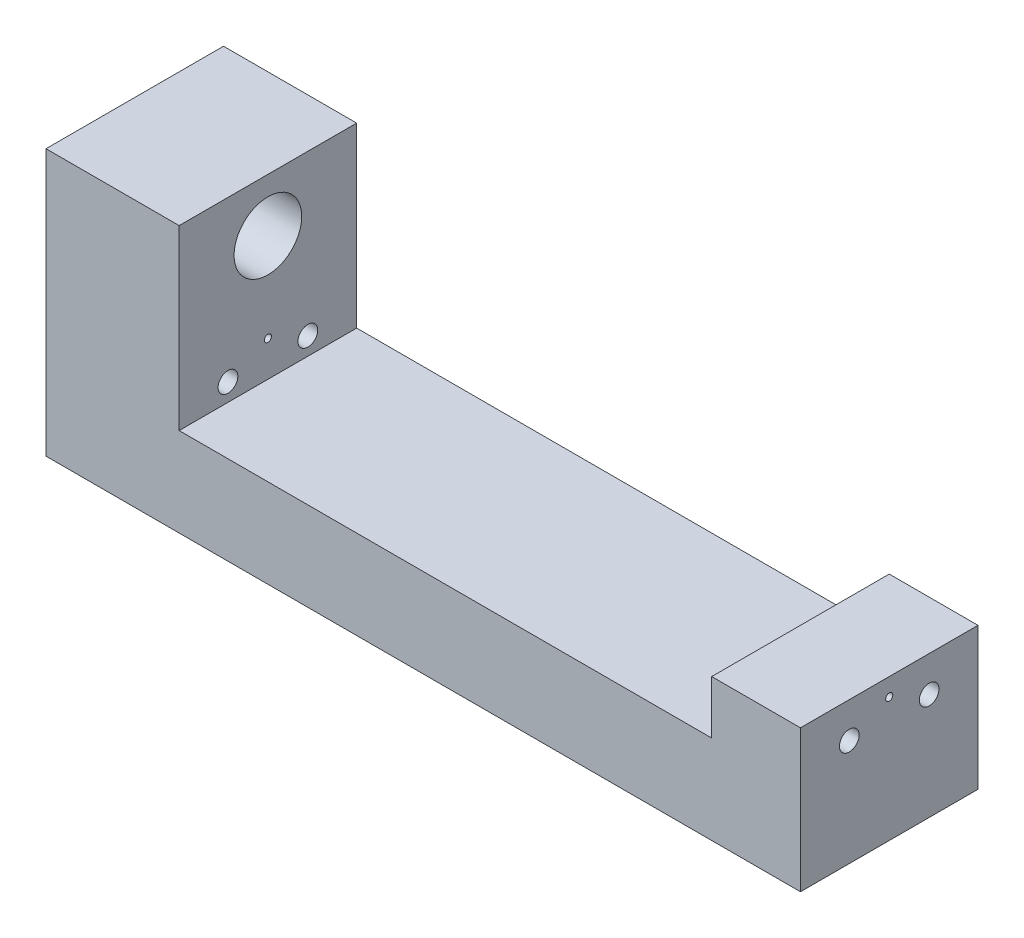
from build123d import *

# Parameters (mm, degrees)
SKETCH1_W               = 850
SKETCH1_H               = 200
BOSS_EXTRUDE1_DEPTH     = 100
SKETCH2_W               = 150
SKETCH2_H               = 200
BOSS_EXTRUDE2_DEPTH     = 200
SKETCH4_W               = 100
SKETCH4_H               = 200
BOSS_EXTRUDE3_DEPTH     = 60
CUT_EXTRUDE1_DEPTH      = 924.309265631
CUT_EXTRUDE1_DEPTH_BACK = 924.309265631
SKETCH3_R               = 38.1
SKETCH3_R_2             = 11.11
SKETCH3_R_3             = 4


with BuildPart() as part:
    # Sketch1 → Boss-Extrude1 (new body)
    with BuildSketch(Plane(origin=(0, 0, 0), x_dir=(1, 0, 0), z_dir=(0, 1, 0))):
        with Locations((425, 100)):
            Rectangle(SKETCH1_W, SKETCH1_H)
    extrude(amount=BOSS_EXTRUDE1_DEPTH)

    # Sketch2 → Boss-Extrude2 (add)
    with BuildSketch(Plane(origin=(0, 100, 0), x_dir=(1, 0, 0), z_dir=(0, 1, 0))):
        with Locations((75, 100)):
            Rectangle(SKETCH2_W, SKETCH2_H)
    extrude(amount=BOSS_EXTRUDE2_DEPTH)

    # Sketch4 → Boss-Extrude3 (add)
    with BuildSketch(Plane(origin=(0, 100, 0), x_dir=(1, 0, 0), z_dir=(0, 1, 0))):
        with Locations((800, 100)):
            Rectangle(SKETCH4_W, SKETCH4_H)
    extrude(amount=BOSS_EXTRUDE3_DEPTH)

    # Sketch3 → Cut-Extrude1 (cut, two sides: drawn at the far end of the back side and taken through both)
    with BuildSketch(Plane.ZY.offset(-CUT_EXTRUDE1_DEPTH_BACK)):
        with Locations((-100, 240)):
            Circle(SKETCH3_R)
        with Locations((-145, 120)):
            Circle(SKETCH3_R_2)
        with Locations(Location((-55, 120, 0), (0, 0, 180))):
            Circle(SKETCH3_R_2)
        with Locations((-100, 140)):
            Circle(SKETCH3_R_3)
    extrude(amount=CUT_EXTRUDE1_DEPTH + CUT_EXTRUDE1_DEPTH_BACK, mode=Mode.SUBTRACT)


solid = part.part
